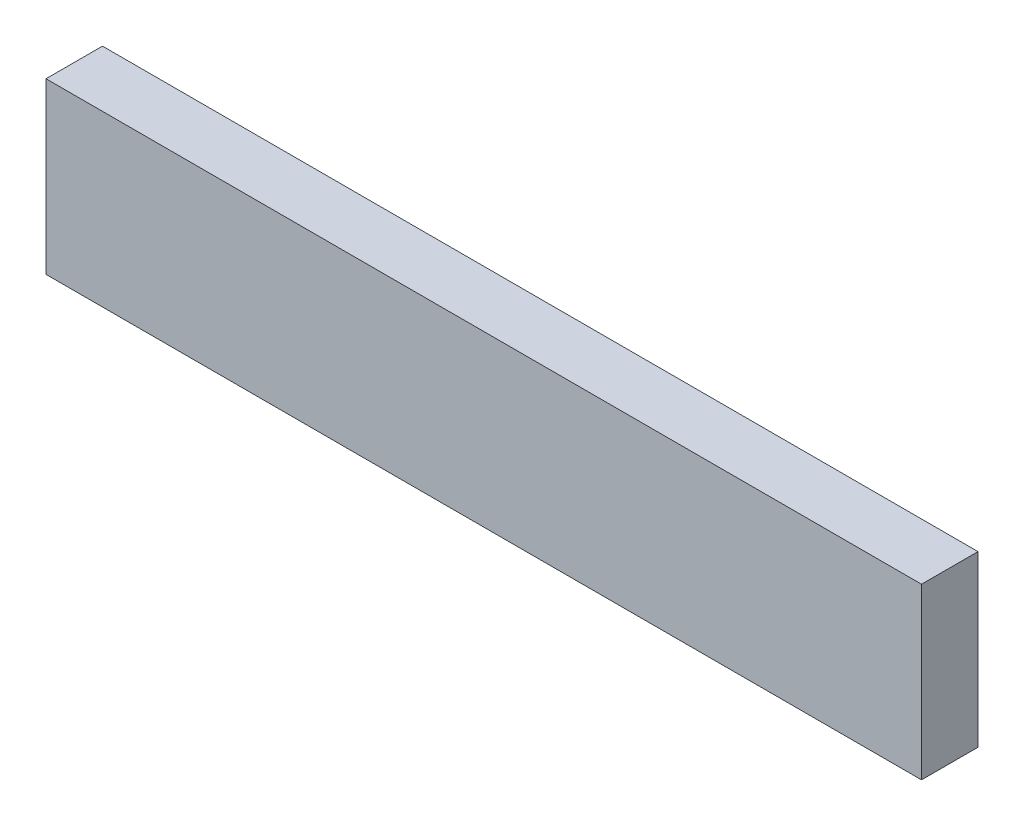
from build123d import *

# Parameters (mm, degrees)
SKETCH_1_W      = 310
SKETCH_1_H      = 60
EXTRUDE_1_DEPTH = 20


with BuildPart() as part:
    # 草图1 → 凸台-拉伸1 (new body)
    with BuildSketch(Plane.XY):
        Rectangle(SKETCH_1_W, SKETCH_1_H)
    extrude(amount=EXTRUDE_1_DEPTH)


solid = part.part
